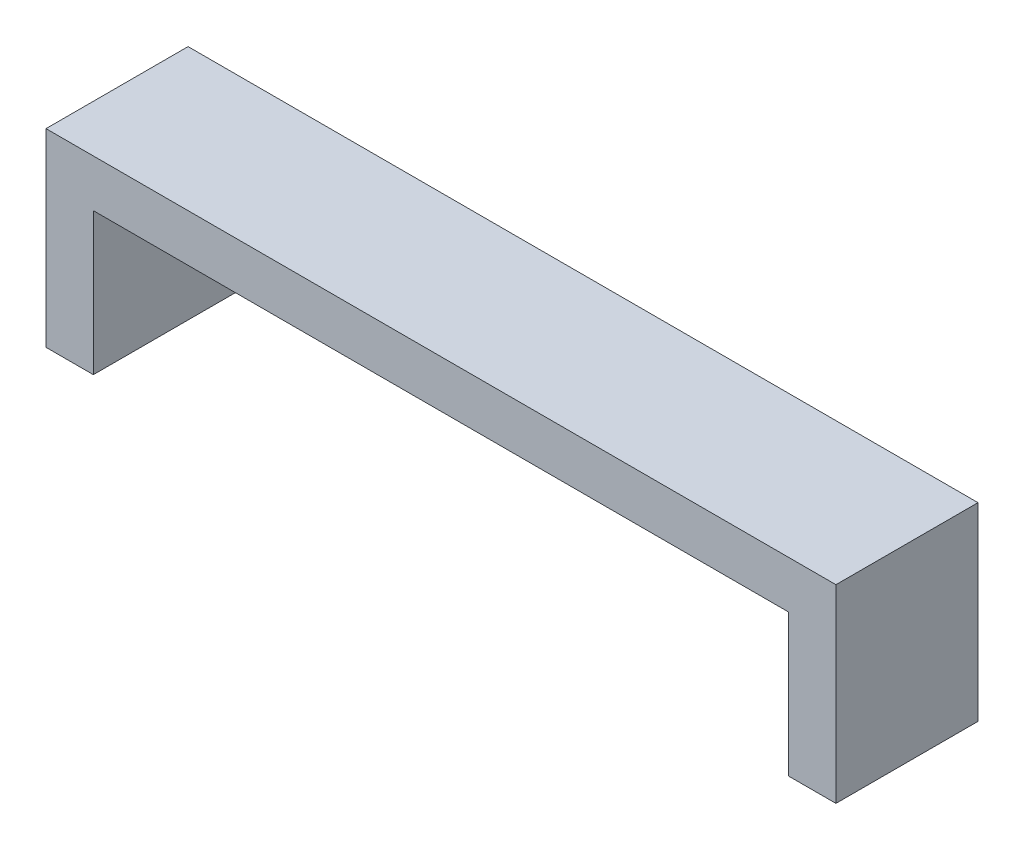
from build123d import *

# Parameters (mm, degrees)
SKETCH1_W           = 52.959
SKETCH1_H           = 9.525
BOSS_EXTRUDE3_DEPTH = 3.175
BOSS_EXTRUDE4_DEPTH = 9.525


with BuildPart() as part:
    # Sketch1 → Boss-Extrude3 (new body)
    with BuildSketch(Plane.XY):
        Rectangle(SKETCH1_W, SKETCH1_H)
    extrude(amount=BOSS_EXTRUDE3_DEPTH)

    # Sketch2 → Boss-Extrude4 (add)
    with BuildSketch(Plane.XY):
        Polygon((-26.4795, 4.7625), (-26.4795, -7.9375), (-23.3045, -7.9375), (-23.3045, 1.5875), (23.3045, 1.5875), (23.3045, -7.9375), (26.4795, -7.9375), (26.4795, 4.7625), align=None)
    extrude(amount=BOSS_EXTRUDE4_DEPTH)


solid = part.part
